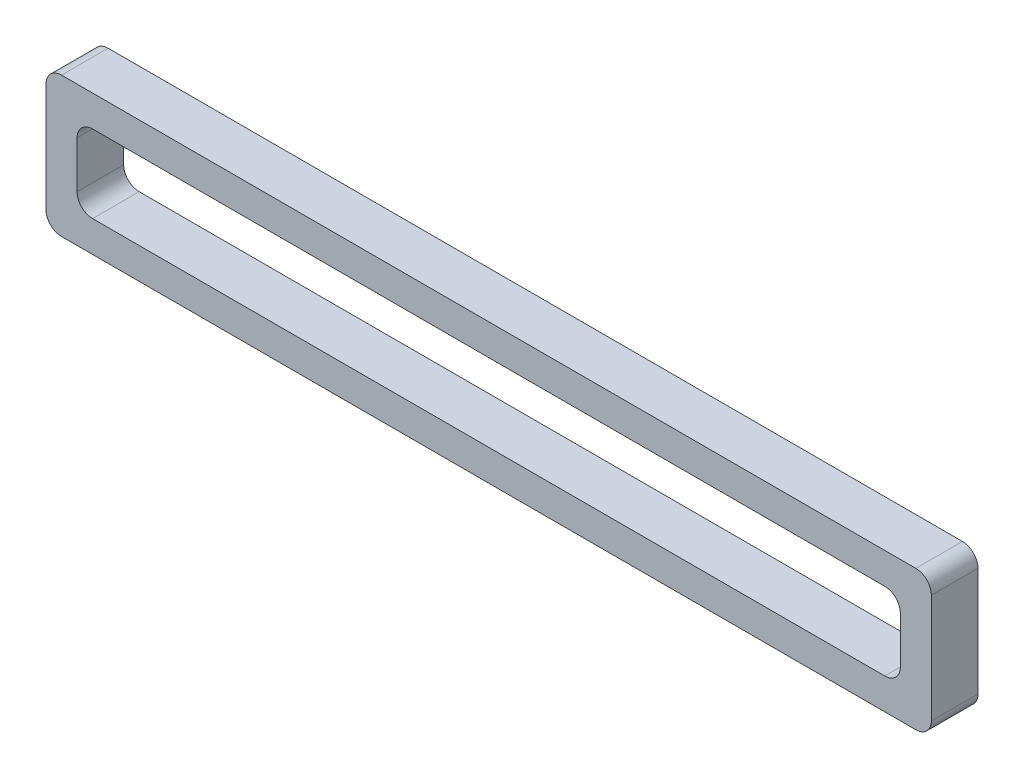
from build123d import *

# Parameters (mm, degrees)
BOSS_EXTRUDE1_DEPTH = 3


with BuildPart() as part:
    # Sketch1 → Boss-Extrude1 (new body)
    with BuildSketch(Plane.XY):
        with BuildLine():
            Line((-27.5, 4.5), (27.5, 4.5))
            ThreePointArc((27.5, 4.5), (28.207106781, 4.207106781), (28.5, 3.5))
            Line((28.5, 3.5), (28.5, -3.5))
            ThreePointArc((28.5, -3.5), (28.207106781, -4.207106781), (27.5, -4.5))
            Line((27.5, -4.5), (-27.5, -4.5))
            ThreePointArc((-27.5, -4.5), (-28.207106781, -4.207106781), (-28.5, -3.5))
            Line((-28.5, -3.5), (-28.5, 3.5))
            ThreePointArc((-28.5, 3.5), (-28.207106781, 4.207106781), (-27.5, 4.5))
        make_face()
        with BuildLine():
            Line((-25.5, 2.5), (25.5, 2.5))
            ThreePointArc((25.5, 2.5), (26.207106781, 2.207106781), (26.5, 1.5))
            Line((26.5, 1.5), (26.5, -1.5))
            ThreePointArc((26.5, -1.5), (26.207106781, -2.207106781), (25.5, -2.5))
            Line((25.5, -2.5), (-25.5, -2.5))
            ThreePointArc((-25.5, -2.5), (-26.207106781, -2.207106781), (-26.5, -1.5))
            Line((-26.5, -1.5), (-26.5, 1.5))
            ThreePointArc((-26.5, 1.5), (-26.207106781, 2.207106781), (-25.5, 2.5))
        make_face(mode=Mode.SUBTRACT)
    extrude(amount=BOSS_EXTRUDE1_DEPTH)


solid = part.part
